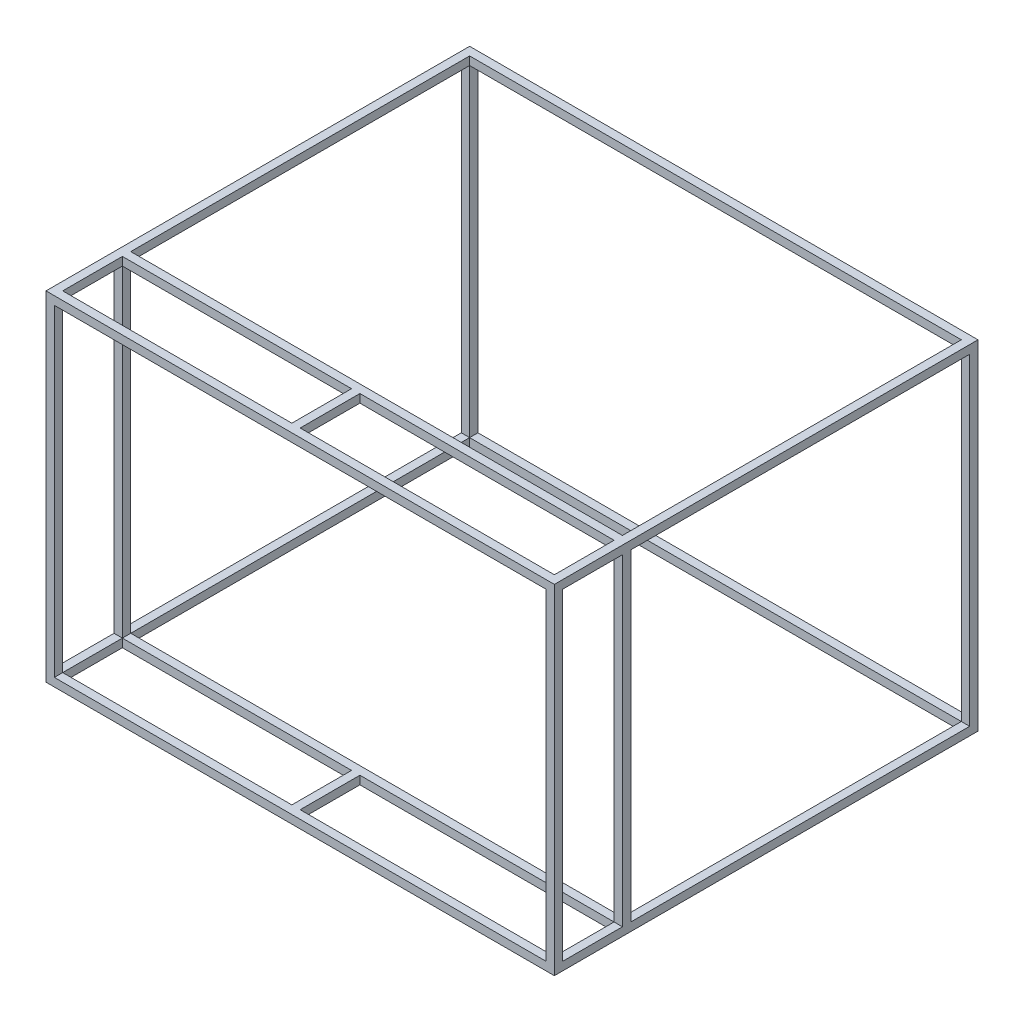
from build123d import *

# Parameters (mm, degrees)
SKETCH1_W               = 914.4
SKETCH1_H               = 609.6
SKETCH1_W_2             = 884.4
SKETCH1_H_2             = 579.6
BOSS_EXTRUDE2_DEPTH     = 762
SKETCH4_W               = 884.4
SKETCH4_H               = 609.6
SKETCH4_W_2             = 412.2
SKETCH4_H_2             = 107.4
SKETCH4_W_3             = 457.2
CUT_EXTRUDE3_DEPTH      = 762
CUT_EXTRUDE4_DEPTH      = 1374.291942344
CUT_EXTRUDE4_DEPTH_BACK = 1374.291942344
SKETCH5_W               = 107.4
SKETCH5_H               = 579.6
SKETCH5_W_2             = 609.6


with BuildPart() as part:
    # Sketch1 → Boss-Extrude2 (new body)
    with BuildSketch(Plane.XY):
        with Locations((479.545925455, 380.152114317)):
            Rectangle(SKETCH1_W, SKETCH1_H)
        with Locations((479.545925455, 380.152114317)):
            Rectangle(SKETCH1_W_2, SKETCH1_H_2, mode=Mode.SUBTRACT)
    extrude(amount=BOSS_EXTRUDE2_DEPTH)

    # Sketch4 → Cut-Extrude3 (cut)
    with BuildSketch(Plane(origin=(0, 75.352114317, 0), x_dir=(-1, 0, 0), z_dir=(0, -1, 0))):
        with Locations((-479.545925455, -319.8)):
            Rectangle(SKETCH4_W, SKETCH4_H)
        with Locations((-243.445925455, -693.3)):
            Rectangle(SKETCH4_W_2, SKETCH4_H_2)
        with Locations((-693.145925455, -693.3)):
            Rectangle(SKETCH4_W_3, SKETCH4_H_2)
    extrude(amount=-CUT_EXTRUDE3_DEPTH, mode=Mode.SUBTRACT)

    # Sketch5 → Cut-Extrude4 (cut, two sides: drawn at the far end of the back side and taken through both)
    with BuildSketch(Plane(origin=(936.745925455, 0, 0), x_dir=(0, 0, -1), z_dir=(1, 0, 0)).offset(-CUT_EXTRUDE4_DEPTH_BACK)):
        with Locations((-693.3, 380.152114317)):
            Rectangle(SKETCH5_W, SKETCH5_H)
        with Locations((-319.8, 380.152114317)):
            Rectangle(SKETCH5_W_2, SKETCH5_H)
    extrude(amount=CUT_EXTRUDE4_DEPTH + CUT_EXTRUDE4_DEPTH_BACK, mode=Mode.SUBTRACT)


solid = part.part
